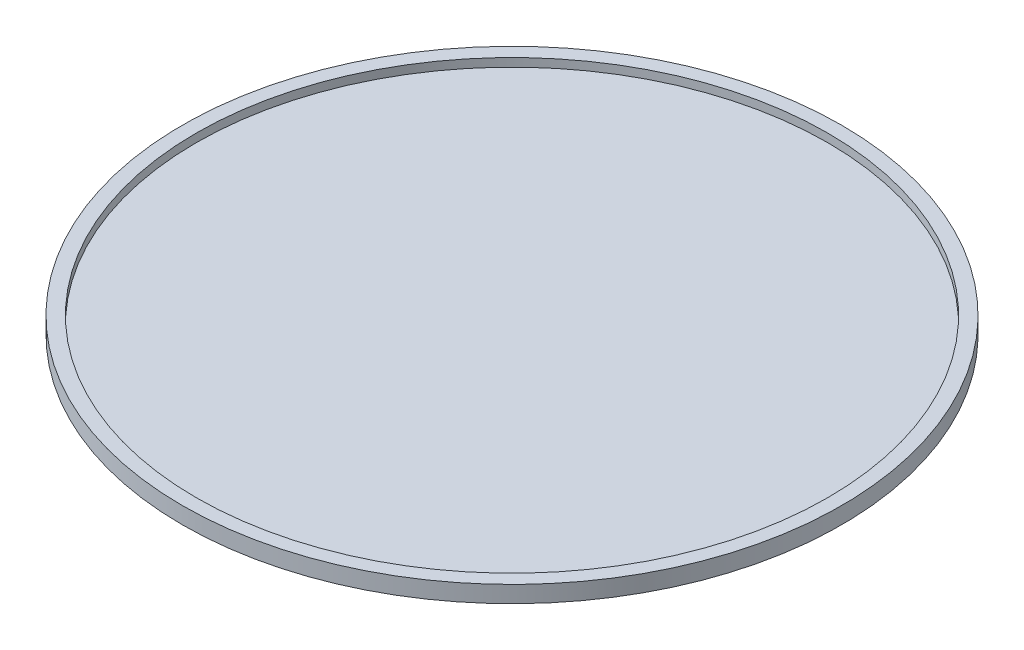
from build123d import *

# Parameters (mm, degrees)
SKETCH1_R           = 100.33
BOSS_EXTRUDE1_DEPTH = 5.08
SKETCH2_R           = 96.139
CUT_EXTRUDE1_DEPTH  = 2.54


with BuildPart() as part:
    # Sketch1 → Boss-Extrude1 (new body)
    with BuildSketch(Plane(origin=(0, 0, 0), x_dir=(1, 0, 0), z_dir=(0, 1, 0))):
        with Locations(Location((0, 0, 0), (0, 0, 270))):
            Circle(SKETCH1_R)
    extrude(amount=BOSS_EXTRUDE1_DEPTH)

    # Sketch2 → Cut-Extrude1 (cut)
    with BuildSketch(Plane(origin=(0, 5.08, 0), x_dir=(1, 0, 0), z_dir=(0, 1, 0))):
        with Locations(Location((0, 0, 0), (0, 0, 270))):
            Circle(SKETCH2_R)
    extrude(amount=-CUT_EXTRUDE1_DEPTH, mode=Mode.SUBTRACT)


solid = part.part
